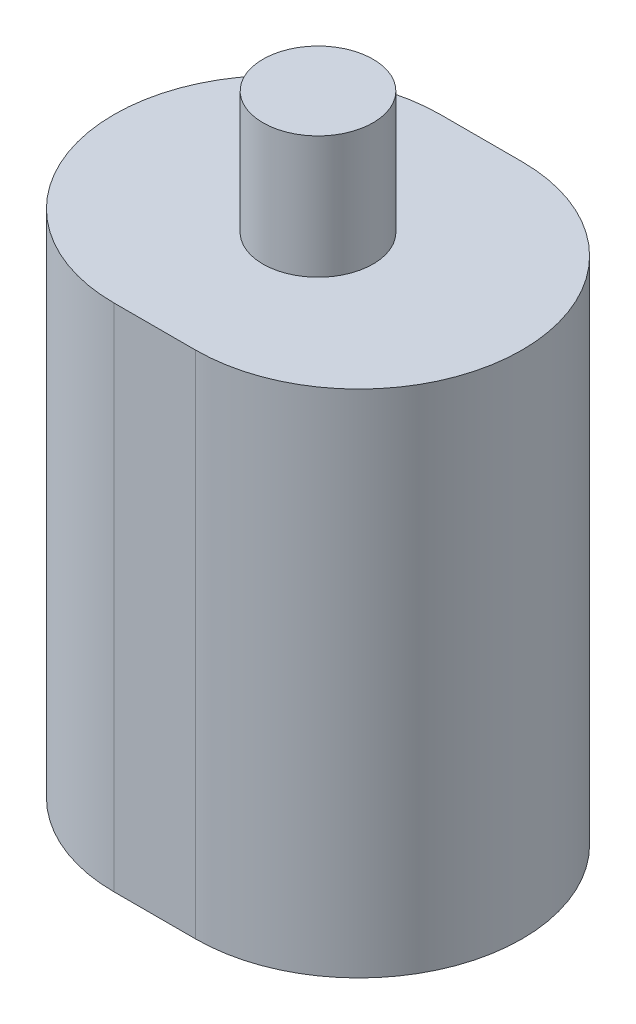
from build123d import *

# Parameters (mm, degrees)
BOSS_EXTRU_1_DEPTH = 12.5
ESQUISSE2_R        = 1.35
BOSS_EXTRU_2_DEPTH = 3


with BuildPart() as part:
    # Esquisse1 → Boss.-Extru.1 (new body)
    with BuildSketch(Plane(origin=(0, 0, 0), x_dir=(1, 0, 0), z_dir=(0, 1, 0))):
        with BuildLine():
            ThreePointArc((0, 4), (1.171572875, 1.171572875), (4, 0))
            Line((4, 0), (6, 0))
            ThreePointArc((6, 0), (8.828427125, 1.171572875), (10, 4))
            ThreePointArc((10, 4), (8.828427125, 6.828427125), (6, 8))
            Line((6, 8), (4, 8))
            ThreePointArc((4, 8), (1.171572875, 6.828427125), (0, 4))
        make_face()
    extrude(amount=BOSS_EXTRU_1_DEPTH)

    # Esquisse2 → Boss.-Extru.2 (add)
    with BuildSketch(Plane(origin=(0, 12.5, 0), x_dir=(1, 0, 0), z_dir=(0, 1, 0))):
        with Locations(Location((5, 4, 0), (0, 0, 270))):
            Circle(ESQUISSE2_R)
    extrude(amount=BOSS_EXTRU_2_DEPTH)


solid = part.part
